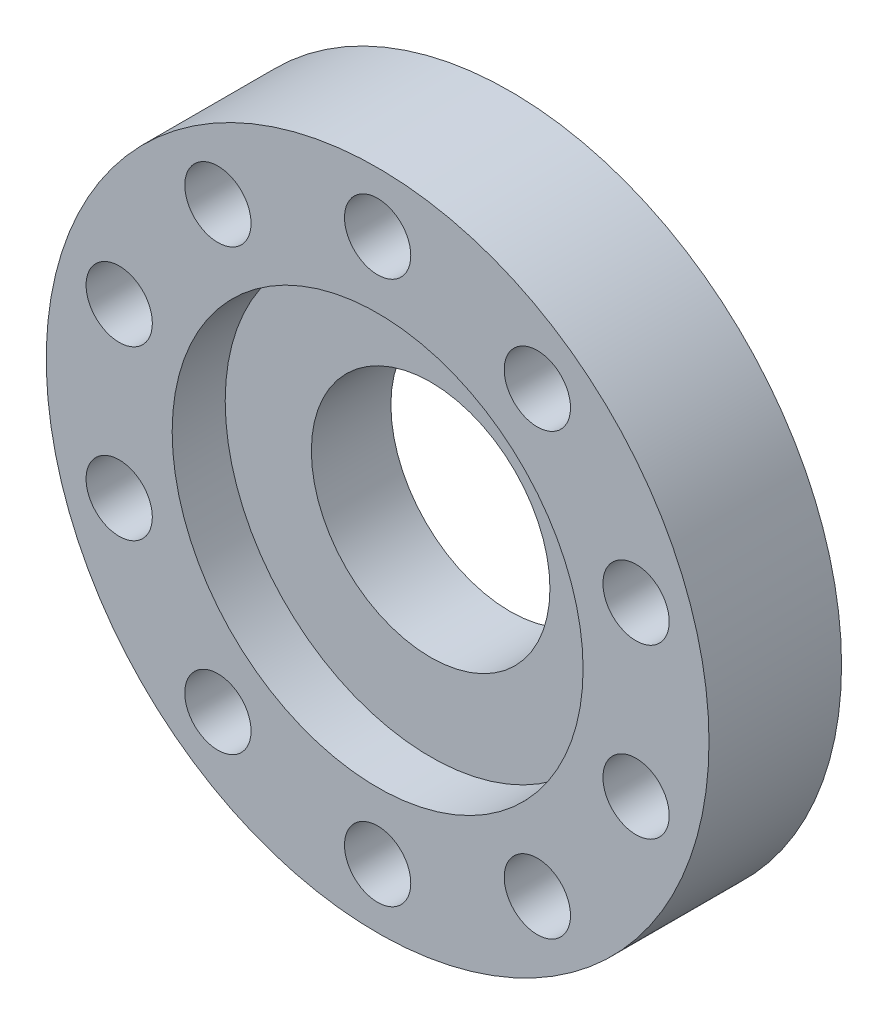
from build123d import *

# Parameters (mm, degrees)
SKETCH1_R           = 50
SKETCH1_R_2         = 18
SKETCH1_R_3         = 5
BOSS_EXTRUDE1_DEPTH = 20
CUT_EXTRUDE1_START  = -8
SKETCH2_R           = 31
SKETCH2_R_2         = 18
CUT_EXTRUDE1_DEPTH  = 8


with BuildPart() as part:
    # Sketch1 → Boss-Extrude1 (new body)
    with BuildSketch(Plane.XY):
        Circle(SKETCH1_R)
        Circle(SKETCH1_R_2, mode=Mode.SUBTRACT)
        with Locations((0, -41)):
            Circle(SKETCH1_R_3, mode=Mode.SUBTRACT)
        with Locations((-24.099195344, -33.169696769)):
            Circle(SKETCH1_R_3, mode=Mode.SUBTRACT)
        with Locations((-38.993317168, -12.669696769)):
            Circle(SKETCH1_R_3, mode=Mode.SUBTRACT)
        with Locations((-38.993317168, 12.669696769)):
            Circle(SKETCH1_R_3, mode=Mode.SUBTRACT)
        with Locations((-24.099195344, 33.169696769)):
            Circle(SKETCH1_R_3, mode=Mode.SUBTRACT)
        with Locations((0, 41)):
            Circle(SKETCH1_R_3, mode=Mode.SUBTRACT)
        with Locations((24.099195344, 33.169696769)):
            Circle(SKETCH1_R_3, mode=Mode.SUBTRACT)
        with Locations((38.993317168, 12.669696769)):
            Circle(SKETCH1_R_3, mode=Mode.SUBTRACT)
        with Locations((38.993317168, -12.669696769)):
            Circle(SKETCH1_R_3, mode=Mode.SUBTRACT)
        with Locations((24.099195344, -33.169696769)):
            Circle(SKETCH1_R_3, mode=Mode.SUBTRACT)
    extrude(amount=BOSS_EXTRUDE1_DEPTH)

    # Sketch2 → Cut-Extrude1 (cut)
    with BuildSketch(Plane.XY.offset(20).offset(CUT_EXTRUDE1_START)):
        Circle(SKETCH2_R)
        Circle(SKETCH2_R_2, mode=Mode.SUBTRACT)
    extrude(amount=CUT_EXTRUDE1_DEPTH, mode=Mode.SUBTRACT)


solid = part.part
